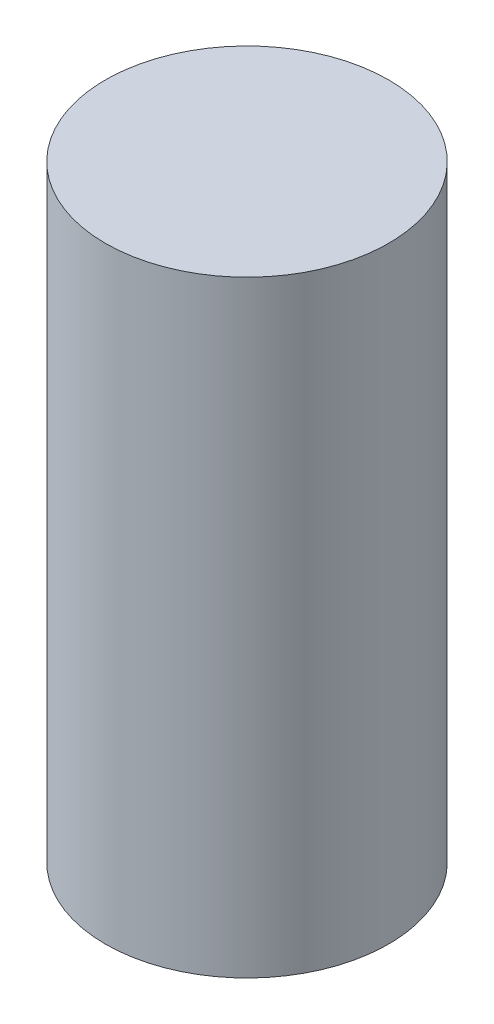
from build123d import *

# Parameters (mm, degrees)
OVEN_KESME_GOBEK_D28_START = 400
SKETCH1_R                  = 14
OVEN_KESME_GOBEK_D28_DEPTH = 60


with BuildPart() as part:
    # Sketch1 → OVEN_kesme_gobek_D28 (new body)
    with BuildSketch(Plane(origin=(0, 0, 0), x_dir=(1, 0, 0), z_dir=(0, 1, 0)).offset(OVEN_KESME_GOBEK_D28_START)):
        with Locations(Location((350, 300, 0), (0, 0, 270))):
            Circle(SKETCH1_R)
    extrude(amount=OVEN_KESME_GOBEK_D28_DEPTH)


solid = part.part
